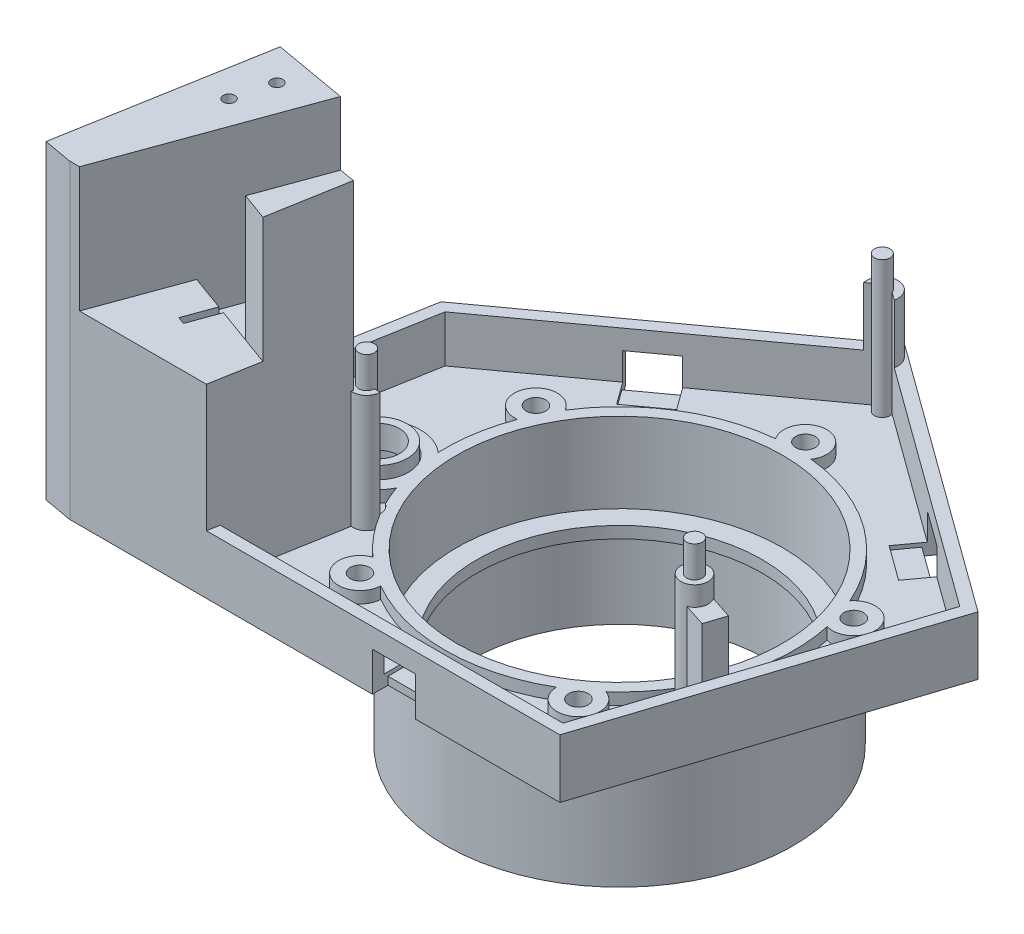
from build123d import *

# Parameters (mm, degrees)
BOSS_EXTRUDE1_DEPTH  = 15
CUT_EXTRUDE2_REACH   = 113.564
SKETCH3_R            = 2.5
SKETCH2_R            = 41.75
CUT_EXTRUDE1_DEPTH   = 30
SHELL1_T             = -3
CUT_EXTRUDE3_DEPTH   = 9
SKETCH6_R            = 6
CUT_EXTRUDE5_DEPTH   = 27
SKETCH7_R            = 7.65
SKETCH7_R_2          = 5.6
BOSS_EXTRUDE2_DEPTH  = 6
SKETCH8_R            = 11
SKETCH8_R_2          = 7.9
BOSS_EXTRUDE3_DEPTH  = 3
SKETCH11_R           = 44.5
SKETCH11_R_2         = 41.75
BOSS_EXTRUDE6_DEPTH  = 14.5
SKETCH13_R           = 44.5
SKETCH13_R_2         = 36.5
BOSS_EXTRUDE7_DEPTH  = 3
SKETCH14_R           = 44.5
SKETCH14_R_2         = 38
BOSS_EXTRUDE8_DEPTH  = 20
BOSS_EXTRUDE9_DEPTH  = 36.5
SKETCH17_W           = 11
SKETCH17_H           = 8
CUT_EXTRUDE6_DEPTH   = 10
SKETCH18_W           = 11
SKETCH18_H           = 4
CUT_EXTRUDE7_DEPTH   = 10
SKETCH19_W           = 11
SKETCH19_H           = 8
CUT_EXTRUDE8_DEPTH   = 10
CUT_EXTRUDE9_DEPTH   = 10
SKETCH22_R           = 3.5
BOSS_EXTRUDE12_DEPTH = 30
SKETCH23_R           = 2
BOSS_EXTRUDE13_DEPTH = 8
BOSS_EXTRUDE14_DEPTH = 25
BOSS_EXTRUDE15_START = -12
SKETCH26_R           = 4
BOSS_EXTRUDE15_DEPTH = 27
SKETCH27_R           = 2
BOSS_EXTRUDE16_DEPTH = 8
BOSS_EXTRUDE17_DEPTH = 40
BOSS_EXTRUDE18_DEPTH = 36.5
BOSS_EXTRUDE19_DEPTH = 8
CUT_EXTRUDE10_DEPTH  = 3
BOSS_EXTRUDE20_DEPTH = 79.5
BOSS_EXTRUDE21_REACH = 141.396
CUT_EXTRUDE13_START  = -30
CUT_EXTRUDE13_DEPTH  = 30
SKETCH35_W           = 11
SKETCH35_H           = 8
CUT_EXTRUDE14_DEPTH  = 10
CUT_EXTRUDE15_DEPTH  = 10
CUT_EXTRUDE17_START  = -27
CUT_EXTRUDE17_DEPTH  = 27
SKETCH39_R           = 1.5
CUT_EXTRUDE18_DEPTH  = 3


with BuildPart() as part:
    # Sketch1 → Boss-Extrude1 (new body)
    with BuildSketch(Plane(origin=(0, 0, 0), x_dir=(1, 0, 0), z_dir=(0, 1, 0))):
        Polygon((-42.5, -57.80155033), (42.5, -57.80155033), (68.766444522, 23.038253555), (0, 73), (-68.766444522, 23.038253555), (-83.020683062, -57.80155033), align=None)
    extrude(amount=BOSS_EXTRUDE1_DEPTH)

    # Sketch3 → Cut-Extrude2 (cut, up to next)
    with BuildSketch(Plane(origin=(0, 15, 0), x_dir=(1, 0, 0), z_dir=(0, 1, 0)), mode=Mode.PRIVATE) as cut_extrude2_sk1:
        with Locations(Location((0, 47.6, 0), (0, 0, 270))):
            Circle(SKETCH3_R)
    cut_extrude2_tool1 = extrude(cut_extrude2_sk1.sketch, amount=-CUT_EXTRUDE2_REACH, mode=Mode.PRIVATE) & part.part
    # Sketch3 → Cut-Extrude2 (cut, up to next)
    with BuildSketch(Plane(origin=(0, 15, 0), x_dir=(1, 0, 0), z_dir=(0, 1, 0)), mode=Mode.PRIVATE) as cut_extrude2_sk2:
        with Locations(Location((45.270290176, 14.709208932, 0), (0, 0, 270))):
            Circle(SKETCH3_R)
    cut_extrude2_tool2 = extrude(cut_extrude2_sk2.sketch, amount=-CUT_EXTRUDE2_REACH, mode=Mode.PRIVATE) & part.part
    # Sketch3 → Cut-Extrude2 (cut, up to next)
    with BuildSketch(Plane(origin=(0, 15, 0), x_dir=(1, 0, 0), z_dir=(0, 1, 0)), mode=Mode.PRIVATE) as cut_extrude2_sk3:
        with Locations(Location((27.978578009, -38.509208932, 0), (0, 0, 270))):
            Circle(SKETCH3_R)
    cut_extrude2_tool3 = extrude(cut_extrude2_sk3.sketch, amount=-CUT_EXTRUDE2_REACH, mode=Mode.PRIVATE) & part.part
    # Sketch3 → Cut-Extrude2 (cut, up to next)
    with BuildSketch(Plane(origin=(0, 15, 0), x_dir=(1, 0, 0), z_dir=(0, 1, 0)), mode=Mode.PRIVATE) as cut_extrude2_sk4:
        with Locations(Location((-27.978578009, -38.509208932, 0), (0, 0, 270))):
            Circle(SKETCH3_R)
    cut_extrude2_tool4 = extrude(cut_extrude2_sk4.sketch, amount=-CUT_EXTRUDE2_REACH, mode=Mode.PRIVATE) & part.part
    # Sketch3 → Cut-Extrude2 (cut, up to next)
    with BuildSketch(Plane(origin=(0, 15, 0), x_dir=(1, 0, 0), z_dir=(0, 1, 0)), mode=Mode.PRIVATE) as cut_extrude2_sk5:
        with Locations(Location((-42.623512289, 21.189530438, 0), (0, 0, 270))):
            Circle(SKETCH3_R)
    cut_extrude2_tool5 = extrude(cut_extrude2_sk5.sketch, amount=-CUT_EXTRUDE2_REACH, mode=Mode.PRIVATE) & part.part
    add(cut_extrude2_tool1.solids().sort_by_distance((0, 15, -47.6))[0], mode=Mode.SUBTRACT)
    add(cut_extrude2_tool2.solids().sort_by_distance((45.27029, 15, -14.709209))[0], mode=Mode.SUBTRACT)
    add(cut_extrude2_tool3.solids().sort_by_distance((27.978578, 15, 38.509209))[0], mode=Mode.SUBTRACT)
    add(cut_extrude2_tool4.solids().sort_by_distance((-27.978578, 15, 38.509209))[0], mode=Mode.SUBTRACT)
    add(cut_extrude2_tool5.solids().sort_by_distance((-42.623512, 15, -21.18953))[0], mode=Mode.SUBTRACT)

    # Sketch2 → Cut-Extrude1 (cut)
    with BuildSketch(Plane(origin=(0, 15, 0), x_dir=(1, 0, 0), z_dir=(0, 1, 0))):
        with Locations(Location((0, 0, 0), (0, 0, 270))):
            Circle(SKETCH2_R)
    extrude(amount=-CUT_EXTRUDE1_DEPTH, mode=Mode.SUBTRACT)

    # Shell1
    shell1_openings = [part.faces().sort_by_distance(p)[0] for p in [
        (-20.260341531, 15, 55.797844322),
    ]]
    offset(amount=SHELL1_T, openings=shell1_openings, kind=Kind.INTERSECTION)

    # Sketch4 → Cut-Extrude3 (cut)
    with BuildSketch(Plane(origin=(0, 15, 0), x_dir=(1, 0, 0), z_dir=(0, 1, 0))):
        Polygon((-57.284049758, 17.655613272), (-34.493230934, -49.024484255), (35.966060659, -47.954410823), (56.721478863, 19.387028456), (-0.91025883, 59.936253349), align=None)
    extrude(amount=-CUT_EXTRUDE3_DEPTH, mode=Mode.SUBTRACT)

    # Sketch6 → Cut-Extrude5 (cut)
    with BuildSketch(Plane(origin=(0, 3, 0), x_dir=(1, 0, 0), z_dir=(0, 1, 0))):
        with Locations(Location((-52, -10, 0), (0, 0, 270))):
            Circle(SKETCH6_R)
    extrude(amount=-CUT_EXTRUDE5_DEPTH, mode=Mode.SUBTRACT)

    # Sketch7 → Boss-Extrude2 (add)
    with BuildSketch(Plane(origin=(0, 3, 0), x_dir=(1, 0, 0), z_dir=(0, 1, 0))):
        with Locations(Location((-52, -10, 0), (0, 0, 90))):
            Circle(SKETCH7_R)
        with Locations(Location((-52, -10, 0), (0, 0, 270))):
            Circle(SKETCH7_R_2, mode=Mode.SUBTRACT)
    extrude(amount=BOSS_EXTRUDE2_DEPTH)

    # Sketch8 → Boss-Extrude3 (add)
    with BuildSketch(Plane(origin=(0, 3, 0), x_dir=(1, 0, 0), z_dir=(0, 1, 0))):
        with Locations((-52, -10)):
            Circle(SKETCH8_R)
        with Locations(Location((-52, -10, 0), (0, 0, 270))):
            Circle(SKETCH8_R_2, mode=Mode.SUBTRACT)
    extrude(amount=BOSS_EXTRUDE3_DEPTH)

    # Sketch11 → Boss-Extrude6 (add)
    with BuildSketch(Plane.XZ):
        with Locations(Location((0, 0, 0), (0, 0, 90))):
            Circle(SKETCH11_R)
        with Locations(Location((0, 0, 0), (0, 0, 90))):
            Circle(SKETCH11_R_2, mode=Mode.SUBTRACT)
    extrude(amount=BOSS_EXTRUDE6_DEPTH)

    # Sketch13 → Boss-Extrude7 (add)
    with BuildSketch(Plane.XZ.offset(14.5)):
        with Locations(Location((0, 0, 0), (0, 0, 90))):
            Circle(SKETCH13_R)
        with Locations(Location((0, 0, 0), (0, 0, 270))):
            Circle(SKETCH13_R_2, mode=Mode.SUBTRACT)
    extrude(amount=BOSS_EXTRUDE7_DEPTH)

    # Sketch14 → Boss-Extrude8 (add)
    with BuildSketch(Plane.XZ.offset(17.5)):
        with Locations(Location((0, 0, 0), (0, 0, 90))):
            Circle(SKETCH14_R)
        with Locations(Location((0, 0, 0), (0, 0, 270))):
            Circle(SKETCH14_R_2, mode=Mode.SUBTRACT)
    extrude(amount=BOSS_EXTRUDE8_DEPTH)

    # Sketch15 → Boss-Extrude9 (add)
    with BuildSketch(Plane(origin=(0, 3, 0), x_dir=(1, 0, 0), z_dir=(0, 1, 0))):
        Polygon((-83.020683062, -57.80155033), (-48.020683062, -57.80155033), (-42.378219679, -25.80155033), (-76.322840543, -19.816197822), align=None)
    extrude(amount=BOSS_EXTRUDE9_DEPTH)

    # Sketch17 → Cut-Extrude6 (cut)
    with BuildSketch(Plane.XY.offset(57.80155033)):
        with Locations((0, 6)):
            Rectangle(SKETCH17_W, SKETCH17_H)
    extrude(amount=-CUT_EXTRUDE6_DEPTH, mode=Mode.SUBTRACT)

    # Sketch18 → Cut-Extrude7 (cut)
    with BuildSketch(Plane.XZ):
        with Locations((0, 55.80155033)):
            Rectangle(SKETCH18_W, SKETCH18_H)
    extrude(amount=-CUT_EXTRUDE7_DEPTH, mode=Mode.SUBTRACT)

    # Sketch19 → Cut-Extrude8 (cut)
    with BuildSketch(Plane(origin=(34.713562845, 0, -47.779120295), x_dir=(-0.8090169943749455, 0, -0.587785252292476), z_dir=(0.587785252292476, 0, -0.8090169943749455))):
        with Locations((-7.822332594, 6)):
            Rectangle(SKETCH19_W, SKETCH19_H)
    extrude(amount=-CUT_EXTRUDE8_DEPTH, mode=Mode.SUBTRACT)

    # Sketch20 → Cut-Extrude9 (cut)
    with BuildSketch(Plane.XZ):
        Polygon((36.59236938, -46.414087445), (45.491556318, -39.94844967), (43.140415309, -36.712381693), (34.24122837, -43.178019468), align=None)
    extrude(amount=-CUT_EXTRUDE9_DEPTH, mode=Mode.SUBTRACT)

    # Sketch22 → Boss-Extrude12 (add)
    with BuildSketch(Plane(origin=(0, 3, 0), x_dir=(1, 0, 0), z_dir=(0, 1, 0))):
        with Locations(Location((42, -22.80155033, 0), (0, 0, 122.8615527))):
            Circle(SKETCH22_R)
    boss_extrude12 = extrude(amount=BOSS_EXTRUDE12_DEPTH)

    # Sketch23 → Boss-Extrude13 (add)
    with BuildSketch(Plane(origin=(0, 33, 0), x_dir=(1, 0, 0), z_dir=(0, 1, 0))):
        with Locations(Location((42, -22.80155033, 0), (0, 0, 270))):
            Circle(SKETCH23_R)
    boss_extrude13 = extrude(amount=BOSS_EXTRUDE13_DEPTH)

    # Sketch24 → Boss-Extrude14 (add)
    with BuildSketch(Plane(origin=(0, 3, 0), x_dir=(1, 0, 0), z_dir=(0, 1, 0))):
        Polygon((43.292584694, -26.05412236), (44.957536855, -20.929926503), (50.717802695, -22.80155033), (49.052850534, -27.925746187), align=None)
    extrude(amount=BOSS_EXTRUDE14_DEPTH)

    # Mirror2: Boss-Extrude12, Boss-Extrude13 across plane
    add(boss_extrude12.mirror(Plane.ZY))
    add(boss_extrude13.mirror(Plane.ZY))

    # Sketch26 → Boss-Extrude15 (add)
    with BuildSketch(Plane(origin=(0, 15, 0), x_dir=(1, 0, 0), z_dir=(0, 1, 0)).offset(BOSS_EXTRUDE15_START)):
        with Locations(Location((0, 67.291796068, 0), (0, 0, 270))):
            Circle(SKETCH26_R)
    extrude(amount=BOSS_EXTRUDE15_DEPTH)

    # Sketch27 → Boss-Extrude16 (add)
    with BuildSketch(Plane(origin=(0, 30, 0), x_dir=(1, 0, 0), z_dir=(0, 1, 0))):
        with Locations(Location((0, 67.291796068, 0), (0, 0, 270))):
            Circle(SKETCH27_R)
    extrude(amount=BOSS_EXTRUDE16_DEPTH)

    # Sketch28 → Boss-Extrude17 (add)
    with BuildSketch(Plane(origin=(0, 39.5, 0), x_dir=(1, 0, 0), z_dir=(0, 1, 0))):
        Polygon((-80.520683062, -57.80155033), (-62.686099478, -8.801434647), (-74.028007046, -6.80155033), (-83.020683062, -57.80155033), align=None)
    extrude(amount=BOSS_EXTRUDE17_DEPTH)

    # Sketch29 → Boss-Extrude18 (add)
    with BuildSketch(Plane(origin=(0, 3, 0), x_dir=(1, 0, 0), z_dir=(0, 1, 0))):
        Polygon((-68.444378519, -21.205383243), (-76.322840543, -19.816197822), (-74.028007046, -6.80155033), (-66.149545022, -8.190735751), align=None)
    extrude(amount=BOSS_EXTRUDE18_DEPTH)

    # Sketch30 → Boss-Extrude19 (add)
    with BuildSketch(Plane(origin=(0, 39.5, 0), x_dir=(1, 0, 0), z_dir=(0, 1, 0))):
        Polygon((-80.520683062, -57.80155033), (-48.020683062, -57.80155033), (-45.852521308, -45.505293994), (-72.513337908, -35.80155033), align=None)
    extrude(amount=BOSS_EXTRUDE19_DEPTH)

    # Sketch31 → Cut-Extrude10 (cut)
    with BuildSketch(Plane(origin=(0, 47.5, 0), x_dir=(1, 0, 0), z_dir=(0, 1, 0))):
        Polygon((-63.586258011, -39.050741692), (-66.322419157, -46.568282658), (-64.443033916, -47.252322944), (-61.706872769, -39.734781978), align=None)
    extrude(amount=-CUT_EXTRUDE10_DEPTH, mode=Mode.SUBTRACT)

    # Sketch32 → Boss-Extrude20 (add)
    with BuildSketch(Plane.XZ):
        Polygon((-83.020683062, 57.80155033), (-90.40674121, 56.499188997), (-81.414065193, 5.499188997), (-74.028007046, 6.80155033), align=None)
    extrude(amount=-BOSS_EXTRUDE20_DEPTH)

    # Boss-Extrude21: up to this face of the body (flat: up to its plane)
    boss_extrude21_end = Plane(part.part.faces().sort_by_distance((-78.082004598, 79.5, 29.590543714))[0])
    # Sketch33 → Boss-Extrude21 (add, up to the picked face)
    with BuildSketch(Plane(origin=(0, 39.5, 0), x_dir=(1, 0, 0), z_dir=(0, 1, 0)), mode=Mode.PRIVATE) as boss_extrude21_sk1:
        Polygon((-42.378219679, -25.80155033), (-46.317450691, -25.106957619), (-52.818963225, -42.969716497), (-45.852521308, -45.505293994), align=None)
    boss_extrude21_tool1 = split(extrude(boss_extrude21_sk1.sketch, amount=BOSS_EXTRUDE21_REACH, mode=Mode.PRIVATE), bisect_by=boss_extrude21_end, keep=Keep.BOTH, mode=Mode.PRIVATE)
    add(boss_extrude21_tool1.solids().sort_by(Axis((-47.069089, 39.5, 35.78787), (0, 1, 0)))[0])

    # Sketch34 → Cut-Extrude13 (cut)
    with BuildSketch(Plane(origin=(0, 33, 0), x_dir=(1, 0, 0), z_dir=(0, 1, 0)).offset(CUT_EXTRUDE13_START)):
        with BuildLine():
            Line((-45.5, -22.80155033), (-44, -22.80155033))
            ThreePointArc((-44, -22.80155033), (-42, -20.80155033), (-40, -22.80155033))
            Line((-40, -22.80155033), (-38.5, -22.80155033))
            ThreePointArc((-38.5, -22.80155033), (-42, -19.30155033), (-45.5, -22.80155033))
        make_face()
    extrude(amount=CUT_EXTRUDE13_DEPTH, mode=Mode.SUBTRACT)

    # Sketch35 → Cut-Extrude14 (cut)
    with BuildSketch(Plane(origin=(-34.713562845, 0, -47.779120295), x_dir=(-0.8090169943749456, 0, 0.5877852522924758), z_dir=(-0.5877852522924758, 0, -0.8090169943749457))):
        with Locations((2.803492824, 6)):
            Rectangle(SKETCH35_W, SKETCH35_H)
    extrude(amount=-CUT_EXTRUDE14_DEPTH, mode=Mode.SUBTRACT)

    # Sketch36 → Cut-Extrude15 (cut)
    with BuildSketch(Plane.XZ):
        Polygon((-41.431229652, -42.89844967), (-39.080088643, -39.662381693), (-30.180901705, -46.128019468), (-32.532042714, -49.364087445), align=None)
    extrude(amount=-CUT_EXTRUDE15_DEPTH, mode=Mode.SUBTRACT)

    # Sketch37 → Cut-Extrude17 (cut)
    with BuildSketch(Plane(origin=(0, 30, 0), x_dir=(1, 0, 0), z_dir=(0, 1, 0)).offset(CUT_EXTRUDE17_START)):
        with BuildLine():
            Line((-4.341716702, 66.137354239), (-1.902113033, 67.909830056))
            ThreePointArc((-1.902113033, 67.909830056), (0, 65.291796068), (1.902113033, 67.909830056))
            Line((1.902113033, 67.909830056), (4.341716702, 66.137354239))
            ThreePointArc((4.341716702, 66.137354239), (0, 62.799219986), (-4.341716702, 66.137354239))
        make_face()
    extrude(amount=CUT_EXTRUDE17_DEPTH, mode=Mode.SUBTRACT)

    # Sketch39 → Cut-Extrude18 (cut)
    with BuildSketch(Plane(origin=(0, 79.5, 0), x_dir=(1, 0, 0), z_dir=(0, 1, 0))):
        with Locations(Location((-73.866343148, -13.910577842, 0), (0, 0, 270))):
            Circle(SKETCH39_R)
        with Locations(Location((-76.46100145, -23.568100728, 0), (0, 0, 270))):
            Circle(SKETCH39_R)
    extrude(amount=-CUT_EXTRUDE18_DEPTH, mode=Mode.SUBTRACT)


solid = part.part
